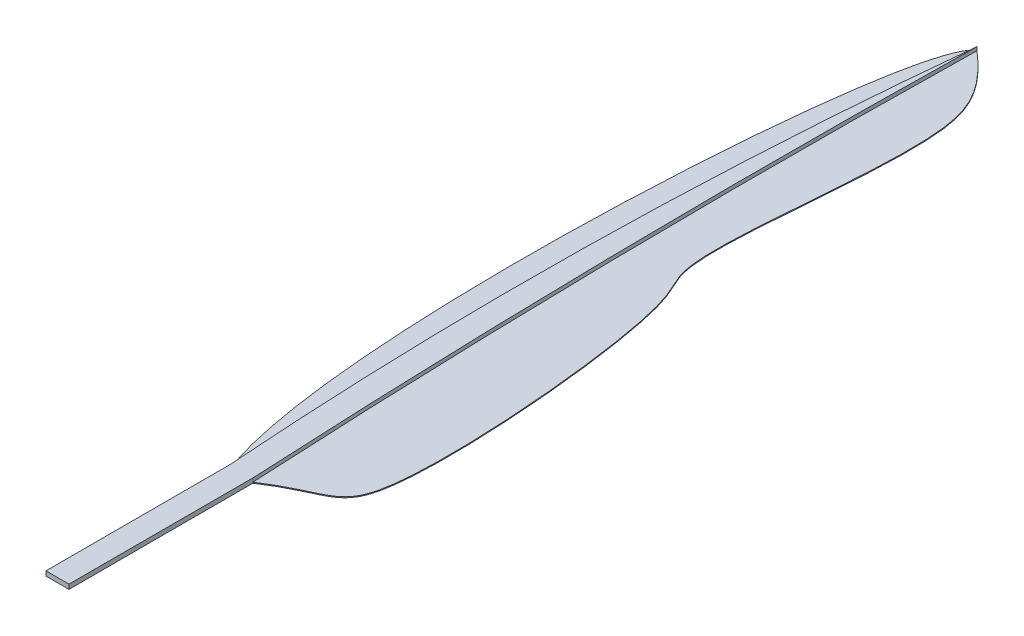
from build123d import *

# Parameters (mm, degrees)
BOSS_EXTRUDE1_DEPTH = 1
BOSS_EXTRUDE2_DEPTH = 0.2


with BuildPart() as part:
    # Sketch2 → Boss-Extrude1 (new body)
    with BuildSketch(Plane(origin=(0, 0, 0), x_dir=(1, 0, 0), z_dir=(0, 1, 0))):
        with BuildLine():
            add(Edge.make_bspline(
                [(-2.5, 0), (-8.331510312, 79.88522278), (0, 160)],
                knots=[0, 0, 0, 1, 1, 1], degree=2))
            Line((-2.5, 0), (-2.5, -40))
            Line((-2.5, -40), (2.5, -40))
            Line((2.5, -40), (2.5, 0))
            add(Edge.make_bspline(
                [(2.5, 0), (-1.639184348, 79.830180153), (0, 160)],
                knots=[0, 0, 0, 1, 1, 1], degree=2))
        make_face()
    extrude(amount=BOSS_EXTRUDE1_DEPTH)

    # Sketch2<4> → Boss-Extrude2 (add)
    with BuildSketch(Plane(origin=(0, 0, 0), x_dir=(1, 0, 0), z_dir=(0, 1, 0))):
        with BuildLine():
            add(Edge.make_bspline(
                [(0, 160), (-8.98258689, 157.028093124), (-16.499984948, 35.906479253), (-2.5, 0)],
                knots=[0, 0, 0, 0, 1, 1, 1, 1], degree=3))
            add(Edge.make_bspline(
                [(-2.5, 0), (-8.331510312, 79.88522278), (0, 160)],
                knots=[0, 0, 0, 1, 1, 1], degree=2))
        make_face()
        with BuildLine():
            add(Edge.make_bspline(
                [(2.5, 0), (12.171354382, 6.467777283), (22.699450058, 1.261618492), (16.020181883, 76.776452349), (5.943994757, 89.557886893), (14.633418631, 135.720154628), (8.585224938, 152.595946761), (0, 160)],
                knots=[0, 0, 0, 0, 0.195491686, 0.494280015, 0.568689677, 0.865178642, 1, 1, 1, 1], degree=3))
            add(Edge.make_bspline(
                [(2.5, 0), (-1.639184348, 79.830180153), (0, 160)],
                knots=[0, 0, 0, 1, 1, 1], degree=2))
        make_face()
    extrude(amount=BOSS_EXTRUDE2_DEPTH)


solid = part.part
